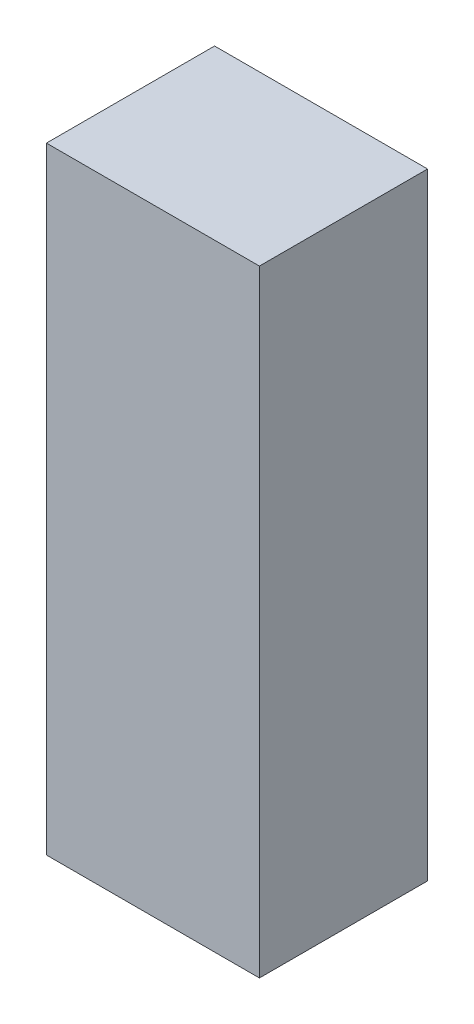
from build123d import *

# Parameters (mm, degrees)
SKETCH1_W           = 95
SKETCH1_H           = 75
BOSS_EXTRUDE1_DEPTH = 137.5


with BuildPart() as part:
    # Sketch1 → Boss-Extrude1 (new, symmetric)
    with BuildSketch(Plane(origin=(0, 0, 0), x_dir=(1, 0, 0), z_dir=(0, 1, 0))):
        Rectangle(SKETCH1_W, SKETCH1_H)
    extrude(amount=BOSS_EXTRUDE1_DEPTH, both=True)


solid = part.part
